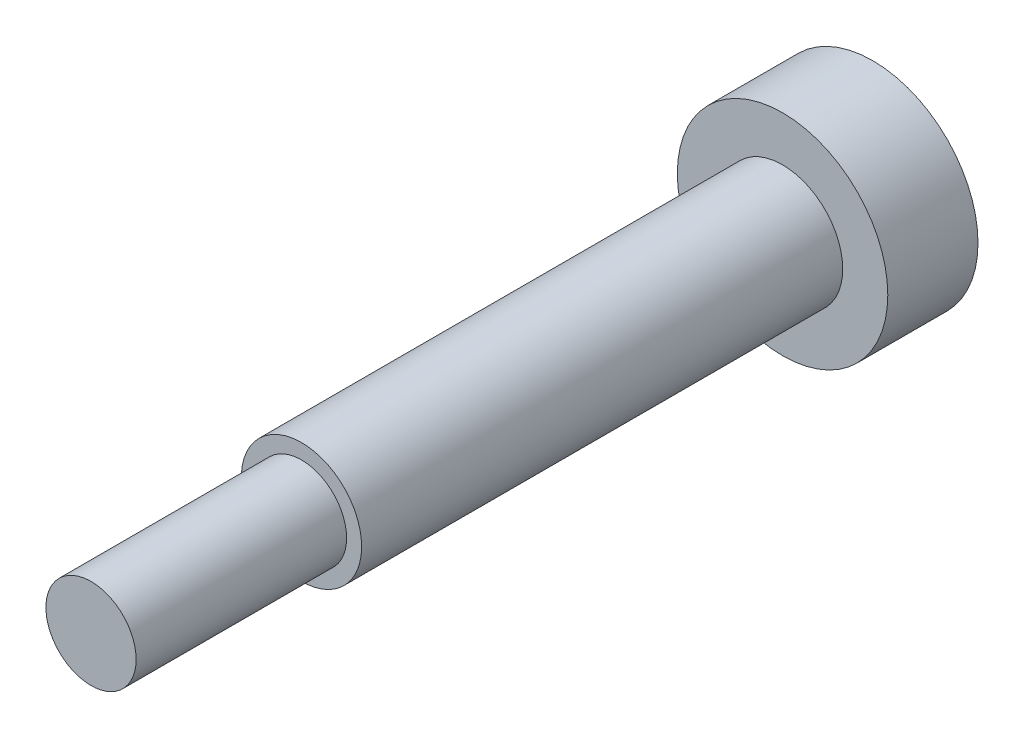
from build123d import *

# Parameters (mm, degrees)
F_01_START                             = -3
S01_SOCKET_HEAD_R                      = 3.5
F_01_SOCKET_HEAD_DEPTH                 = 3
S02_GROUND_SHOULDER_R                  = 2
F_02_GROUND_SHOULDER_DEPTH             = 16
F_03_START                             = 16
S03_THREADED_TIP_MAJOR_DIAMETER_R      = 1.5
F_03_THREADED_TIP_MAJOR_DIAMETER_DEPTH = 7
F_04_START                             = -3.1
F_04_HEXAGONAL_DRIVE_DEPTH             = 2.14


with BuildPart() as part:
    # S01 - Socket head → 01 - Socket head (new body)
    with BuildSketch(Plane.XY.offset(F_01_START)):
        Circle(S01_SOCKET_HEAD_R)
    extrude(amount=F_01_SOCKET_HEAD_DEPTH)

    # S02 - Ground shoulder → 02 - Ground shoulder (add)
    with BuildSketch(Plane.XY):
        Circle(S02_GROUND_SHOULDER_R)
    extrude(amount=F_02_GROUND_SHOULDER_DEPTH)

    # S03 - Threaded tip major diameter → 03 - Threaded tip major diameter (add)
    with BuildSketch(Plane.XY.offset(F_03_START)):
        Circle(S03_THREADED_TIP_MAJOR_DIAMETER_R)
    extrude(amount=F_03_THREADED_TIP_MAJOR_DIAMETER_DEPTH)

    # S04 - Hexagonal drive → 04 - Hexagonal drive (cut)
    with BuildSketch(Plane.XY.offset(F_04_START)):
        Polygon((1.154700538, 0), (0.577350269, 1), (-0.577350269, 1), (-1.154700538, 0), (-0.577350269, -1), (0.577350269, -1), align=None)
    extrude(amount=F_04_HEXAGONAL_DRIVE_DEPTH, mode=Mode.SUBTRACT)


solid = part.part
